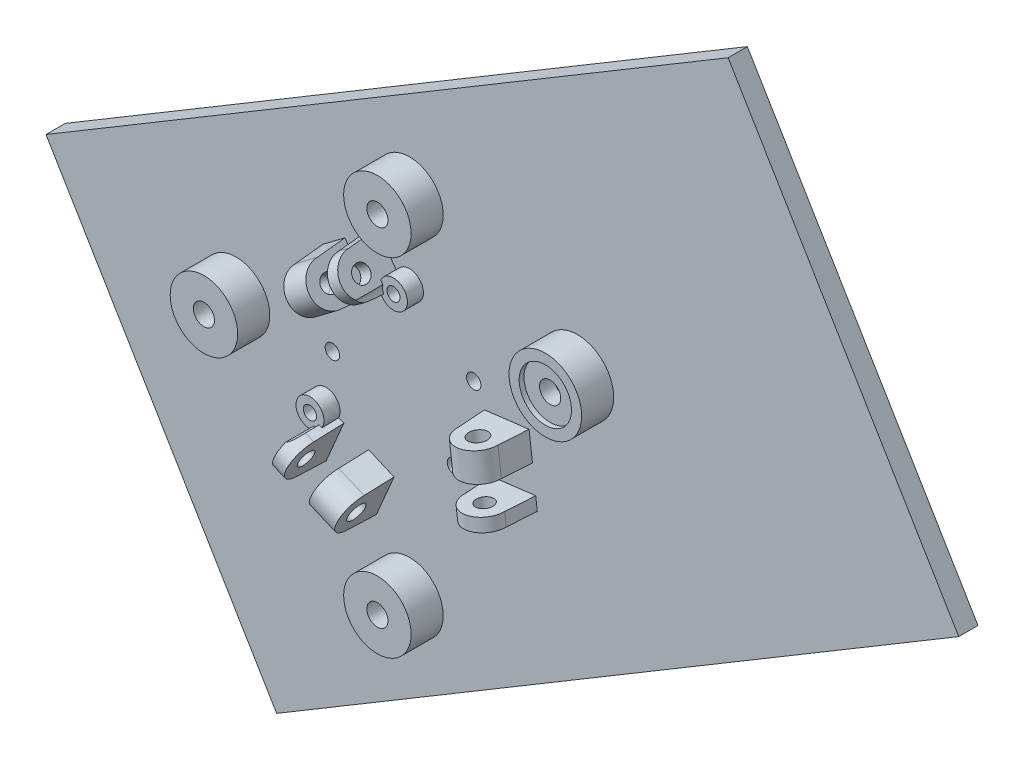
from build123d import *

# Parameters (mm, degrees)
F_01_START                                    = -12
F_01_PULLED_END_PLATE_OUTLINE_DEPTH           = 6
F_02_START                                    = -12.1
S02_CAGE_AND_TRACK_MOUNTING_HOLES_M6_R        = 3.3
F_02_CAGE_AND_TRACK_MOUNTING_HOLES_M6_DEPTH   = 6.2
F_03_START                                    = -12.1
S03_RESERVED_CASSETTE_PATTERN_M4_R            = 2.25
F_03_RESERVED_CASSETTE_PATTERN_M4_DEPTH       = 6.2
F_04_START                                    = -7.5
S04_TRACK_POST_LOCATING_SEAT_R                = 8.15
F_04_TRACK_POST_LOCATING_SEAT_DEPTH           = 1.6
F_05_START                                    = -6
S05_THREE_TENDON_GUIDE_BOSSES_R               = 4.35
F_05_THREE_TENDON_GUIDE_BOSSES_DEPTH          = 5
F_06_START                                    = 4.2
F_06_PIVOT_1_NEAR_CHEEK_DEPTH                 = 4
F_07_START                                    = -12.8
F_07_PIVOT_1_INSERT_CHEEK_DEPTH               = 8.6
F_08_START                                    = -12.9
S08_PIVOT_1_PIN_PILOT_R                       = 2.1
F_08_PIVOT_1_PIN_PILOT_DEPTH                  = 21.2
F_09_START                                    = -7.95
S09_PIVOT_1_SMOOTH_SHOULDER_BEARING_R         = 2.6
F_09_PIVOT_1_SMOOTH_SHOULDER_BEARING_DEPTH    = 16.25
F_10_START                                    = -12.9
S10_PIVOT_1_M4_SHORT_INSERT_SEAT_R            = 2.85
F_10_PIVOT_1_M4_SHORT_INSERT_SEAT_DEPTH       = 5.1
F_11_START                                    = 4.2
F_11_PIVOT_2_NEAR_CHEEK_DEPTH                 = 4
F_12_START                                    = -12.8
F_12_PIVOT_2_INSERT_CHEEK_DEPTH               = 8.6
F_13_START                                    = -12.9
S13_PIVOT_2_PIN_PILOT_R                       = 2.1
F_13_PIVOT_2_PIN_PILOT_DEPTH                  = 21.2
F_14_START                                    = -7.95
S14_PIVOT_2_SMOOTH_SHOULDER_BEARING_R         = 2.6
F_14_PIVOT_2_SMOOTH_SHOULDER_BEARING_DEPTH    = 16.25
F_15_START                                    = -12.9
S15_PIVOT_2_M4_SHORT_INSERT_SEAT_R            = 2.85
F_15_PIVOT_2_M4_SHORT_INSERT_SEAT_DEPTH       = 5.1
F_16_START                                    = 4.2
F_16_PIVOT_3_NEAR_CHEEK_DEPTH                 = 4
F_17_START                                    = -12.8
F_17_PIVOT_3_INSERT_CHEEK_DEPTH               = 8.6
F_18_START                                    = -12.9
S18_PIVOT_3_PIN_PILOT_R                       = 2.1
F_18_PIVOT_3_PIN_PILOT_DEPTH                  = 21.2
F_19_START                                    = -7.95
S19_PIVOT_3_SMOOTH_SHOULDER_BEARING_R         = 2.6
F_19_PIVOT_3_SMOOTH_SHOULDER_BEARING_DEPTH    = 16.25
F_20_START                                    = -12.9
S20_PIVOT_3_M4_SHORT_INSERT_SEAT_R            = 2.85
F_20_PIVOT_3_M4_SHORT_INSERT_SEAT_DEPTH       = 5.1
F_21_START                                    = -12.1
S21_TENDON_EYELET_SEATS_R                     = 2.05
F_21_TENDON_EYELET_SEATS_DEPTH                = 11.2
F_22_START                                    = -1
S22_CLEAR_THE_THREE_EYELET_FLANGES_AND_R      = 3.4
F_22_CLEAR_THE_THREE_EYELET_FLANGES_AND_DEPTH = 12
F_01_START_2                                  = -6.15
S01_RAISED_CAGE_SEATS_10_MM_R                 = 10.5
S01_RAISED_CAGE_SEATS_10_MM_R_2               = 11.3
F_01_RAISED_CAGE_SEATS_10_MM_DEPTH            = 10.15
S02_CAGE_SCREW_THROUGH_HOLES_R                = 3.3
F_02_CAGE_SCREW_THROUGH_HOLES_DEPTH           = 16.2
F_03_START_2                                  = -12.15
S03_RECESSED_FRAME_SCREW_HEAD_SEATS_R         = 6.15
F_03_RECESSED_FRAME_SCREW_HEAD_SEATS_DEPTH    = 10.15
F_04_START_2                                  = -12.15
S04_RECESSED_TRACK_POST_WASHER_SEAT_R         = 7.3
F_04_RECESSED_TRACK_POST_WASHER_SEAT_DEPTH    = 10.15
F_05_START_2                                  = 2.5
S05_TRACK_POST_LOCATION_REGISTER_R            = 8.15
F_05_TRACK_POST_LOCATION_REGISTER_DEPTH       = 1.6


with BuildPart() as part:
    # S01 - Pulled end plate outline → 01 - Pulled end plate outline (new body)
    with BuildSketch(Plane.XY.offset(F_01_START)):
        Polygon((170.996313, 20.6243307), (-41.3567354, -106.252626), (-113.163433, 13.929728), (99.1896147, 140.806684), align=None)
    extrude(amount=F_01_PULLED_END_PLATE_OUTLINE_DEPTH)

    # S02 - Cage and track mounting holes - M6 → 02 - Cage and track mounting holes - M6 (cut)
    with BuildSketch(Plane.XY.offset(F_02_START)):
        with Locations((0, 54)):
            Circle(S02_CAGE_AND_TRACK_MOUNTING_HOLES_M6_R)
        with Locations((-54, 0)):
            Circle(S02_CAGE_AND_TRACK_MOUNTING_HOLES_M6_R)
        with Locations((0, -54)):
            Circle(S02_CAGE_AND_TRACK_MOUNTING_HOLES_M6_R)
        with Locations((52.287205346, 31.41732257)):
            Circle(S02_CAGE_AND_TRACK_MOUNTING_HOLES_M6_R)
    extrude(amount=F_02_CAGE_AND_TRACK_MOUNTING_HOLES_M6_DEPTH, mode=Mode.SUBTRACT)

    # S03 - Reserved cassette pattern - M4 → 03 - Reserved cassette pattern - M4 (cut)
    with BuildSketch(Plane.XY.offset(F_03_START)):
        with Locations((14, -12)):
            Circle(S03_RESERVED_CASSETTE_PATTERN_M4_R)
        with Locations((20, 14)):
            Circle(S03_RESERVED_CASSETTE_PATTERN_M4_R)
        with Locations((-24, 0)):
            Circle(S03_RESERVED_CASSETTE_PATTERN_M4_R)
    extrude(amount=F_03_RESERVED_CASSETTE_PATTERN_M4_DEPTH, mode=Mode.SUBTRACT)

    # S04 - Track post locating seat → 04 - Track post locating seat (cut)
    with BuildSketch(Plane.XY.offset(F_04_START)):
        with Locations((52.287205346, 31.41732257)):
            Circle(S04_TRACK_POST_LOCATING_SEAT_R)
    extrude(amount=F_04_TRACK_POST_LOCATING_SEAT_DEPTH, mode=Mode.SUBTRACT)

    # S05 - Three tendon guide bosses → 05 - Three tendon guide bosses (add)
    with BuildSketch(Plane.XY.offset(F_05_START)):
        with Locations((25.980762114, -15)):
            Circle(S05_THREE_TENDON_GUIDE_BOSSES_R)
        with Locations((0, 30)):
            Circle(S05_THREE_TENDON_GUIDE_BOSSES_R)
        with Locations((-25.980762114, -15)):
            Circle(S05_THREE_TENDON_GUIDE_BOSSES_R)
    extrude(amount=F_05_THREE_TENDON_GUIDE_BOSSES_DEPTH)

    # S06 - Pivot 1 - near cheek → 06 - Pivot 1 - near cheek (add)
    with BuildSketch(Plane(origin=(0.946263216, -7.706695423, 0), x_dir=(-0.9925461516079791, -0.12186934367670445, 0), z_dir=(0.12186934367670443, -0.992546151607979, 0)).offset(F_06_START)):
        with BuildLine():
            Line((-24.147544543, 6.2), (-38.147544535, 6.2))
            Line((-38.147544535, 6.2), (-37.447544535, -3))
            ThreePointArc((-37.447544535, -3), (-31.147544539, -9.3), (-24.847544543, -3))
            Line((-24.847544543, -3), (-24.147544543, 6.2))
        make_face()
    extrude(amount=F_06_PIVOT_1_NEAR_CHEEK_DEPTH)

    # S07 - Pivot 1 - insert cheek → 07 - Pivot 1 - insert cheek (add)
    with BuildSketch(Plane(origin=(0.946263216, -7.706695423, 0), x_dir=(-0.9925461516079791, -0.12186934367670445, 0), z_dir=(0.12186934367670443, -0.992546151607979, 0)).offset(F_07_START)):
        with BuildLine():
            Line((-24.147544543, 6.2), (-38.147544535, 6.2))
            Line((-38.147544535, 6.2), (-37.447544535, -3))
            ThreePointArc((-37.447544535, -3), (-31.147544539, -9.3), (-24.847544543, -3))
            Line((-24.847544543, -3), (-24.147544543, 6.2))
        make_face()
    extrude(amount=F_07_PIVOT_1_INSERT_CHEEK_DEPTH)

    # S08 - Pivot 1 - pin pilot → 08 - Pivot 1 - pin pilot (cut)
    with BuildSketch(Plane(origin=(0.946263216, -7.706695423, 0), x_dir=(-0.9925461516079791, -0.12186934367670445, 0), z_dir=(0.12186934367670443, -0.992546151607979, 0)).offset(F_08_START)):
        with Locations((-31.147544539, -3)):
            Circle(S08_PIVOT_1_PIN_PILOT_R)
    extrude(amount=F_08_PIVOT_1_PIN_PILOT_DEPTH, mode=Mode.SUBTRACT)

    # S09 - Pivot 1 - smooth shoulder bearing → 09 - Pivot 1 - smooth shoulder bearing (cut)
    with BuildSketch(Plane(origin=(0.946263216, -7.706695423, 0), x_dir=(-0.9925461516079791, -0.12186934367670445, 0), z_dir=(0.12186934367670443, -0.992546151607979, 0)).offset(F_09_START)):
        with Locations((-31.147544539, -3)):
            Circle(S09_PIVOT_1_SMOOTH_SHOULDER_BEARING_R)
    extrude(amount=F_09_PIVOT_1_SMOOTH_SHOULDER_BEARING_DEPTH, mode=Mode.SUBTRACT)

    # S10 - Pivot 1 - M4 short insert seat → 10 - Pivot 1 - M4 short insert seat (cut)
    with BuildSketch(Plane(origin=(0.946263216, -7.706695423, 0), x_dir=(-0.9925461516079791, -0.12186934367670445, 0), z_dir=(0.12186934367670443, -0.992546151607979, 0)).offset(F_10_START)):
        with Locations((-31.147544539, -3)):
            Circle(S10_PIVOT_1_M4_SHORT_INSERT_SEAT_R)
    extrude(amount=F_10_PIVOT_1_M4_SHORT_INSERT_SEAT_DEPTH, mode=Mode.SUBTRACT)

    # S11 - Pivot 2 - near cheek → 11 - Pivot 2 - near cheek (add)
    with BuildSketch(Plane(origin=(6.201062381, 4.672835668, 0), x_dir=(0, 0, -1), z_dir=(0.7986355103156061, 0.6018150227959849, 0)).offset(F_11_START)):
        with BuildLine():
            Line((6.2, 24.14754453), (6.2, 38.147544534))
            Line((6.2, 38.147544534), (-3, 37.447544534))
            ThreePointArc((-3, 37.447544534), (-9.3, 31.147544532), (-3, 24.84754453))
            Line((-3, 24.84754453), (6.2, 24.14754453))
        make_face()
    extrude(amount=F_11_PIVOT_2_NEAR_CHEEK_DEPTH)

    # S12 - Pivot 2 - insert cheek → 12 - Pivot 2 - insert cheek (add)
    with BuildSketch(Plane(origin=(6.201062381, 4.672835668, 0), x_dir=(0, 0, -1), z_dir=(0.7986355103156061, 0.6018150227959849, 0)).offset(F_12_START)):
        with BuildLine():
            Line((6.2, 24.14754453), (6.2, 38.147544534))
            Line((6.2, 38.147544534), (-3, 37.447544534))
            ThreePointArc((-3, 37.447544534), (-9.3, 31.147544532), (-3, 24.84754453))
            Line((-3, 24.84754453), (6.2, 24.14754453))
        make_face()
    extrude(amount=F_12_PIVOT_2_INSERT_CHEEK_DEPTH)

    # S13 - Pivot 2 - pin pilot → 13 - Pivot 2 - pin pilot (cut)
    with BuildSketch(Plane(origin=(6.201062381, 4.672835668, 0), x_dir=(0, 0, -1), z_dir=(0.7986355103156061, 0.6018150227959849, 0)).offset(F_13_START)):
        with Locations((-3, 31.147544532)):
            Circle(S13_PIVOT_2_PIN_PILOT_R)
    extrude(amount=F_13_PIVOT_2_PIN_PILOT_DEPTH, mode=Mode.SUBTRACT)

    # S14 - Pivot 2 - smooth shoulder bearing → 14 - Pivot 2 - smooth shoulder bearing (cut)
    with BuildSketch(Plane(origin=(6.201062381, 4.672835668, 0), x_dir=(0, 0, -1), z_dir=(0.7986355103156061, 0.6018150227959849, 0)).offset(F_14_START)):
        with Locations((-3, 31.147544532)):
            Circle(S14_PIVOT_2_SMOOTH_SHOULDER_BEARING_R)
    extrude(amount=F_14_PIVOT_2_SMOOTH_SHOULDER_BEARING_DEPTH, mode=Mode.SUBTRACT)

    # S15 - Pivot 2 - M4 short insert seat → 15 - Pivot 2 - M4 short insert seat (cut)
    with BuildSketch(Plane(origin=(6.201062381, 4.672835668, 0), x_dir=(0, 0, -1), z_dir=(0.7986355103156061, 0.6018150227959849, 0)).offset(F_15_START)):
        with Locations((-3, 31.147544532)):
            Circle(S15_PIVOT_2_M4_SHORT_INSERT_SEAT_R)
    extrude(amount=F_15_PIVOT_2_M4_SHORT_INSERT_SEAT_DEPTH, mode=Mode.SUBTRACT)

    # S16 - Pivot 3 - near cheek → 16 - Pivot 3 - near cheek (add)
    with BuildSketch(Plane(origin=(-7.147325625, 3.033859732, 0), x_dir=(0, 0, 1), z_dir=(-0.9205048534161142, 0.39073112857485304, 0)).offset(F_16_START)):
        with BuildLine():
            Line((-6.2, -24.147544532), (-6.2, -38.14754453))
            Line((-6.2, -38.14754453), (3, -37.44754453))
            ThreePointArc((3, -37.44754453), (9.3, -31.147544531), (3, -24.847544531))
            Line((3, -24.847544531), (-6.2, -24.147544532))
        make_face()
    extrude(amount=F_16_PIVOT_3_NEAR_CHEEK_DEPTH)

    # S17 - Pivot 3 - insert cheek → 17 - Pivot 3 - insert cheek (add)
    with BuildSketch(Plane(origin=(-7.147325625, 3.033859732, 0), x_dir=(0, 0, 1), z_dir=(-0.9205048534161142, 0.39073112857485304, 0)).offset(F_17_START)):
        with BuildLine():
            Line((-6.2, -24.147544532), (-6.2, -38.14754453))
            Line((-6.2, -38.14754453), (3, -37.44754453))
            ThreePointArc((3, -37.44754453), (9.3, -31.147544531), (3, -24.847544531))
            Line((3, -24.847544531), (-6.2, -24.147544532))
        make_face()
    extrude(amount=F_17_PIVOT_3_INSERT_CHEEK_DEPTH)

    # S18 - Pivot 3 - pin pilot → 18 - Pivot 3 - pin pilot (cut)
    with BuildSketch(Plane(origin=(-7.147325625, 3.033859732, 0), x_dir=(0, 0, 1), z_dir=(-0.9205048534161142, 0.39073112857485304, 0)).offset(F_18_START)):
        with Locations((3, -31.147544531)):
            Circle(S18_PIVOT_3_PIN_PILOT_R)
    extrude(amount=F_18_PIVOT_3_PIN_PILOT_DEPTH, mode=Mode.SUBTRACT)

    # S19 - Pivot 3 - smooth shoulder bearing → 19 - Pivot 3 - smooth shoulder bearing (cut)
    with BuildSketch(Plane(origin=(-7.147325625, 3.033859732, 0), x_dir=(0, 0, 1), z_dir=(-0.9205048534161142, 0.39073112857485304, 0)).offset(F_19_START)):
        with Locations((3, -31.147544531)):
            Circle(S19_PIVOT_3_SMOOTH_SHOULDER_BEARING_R)
    extrude(amount=F_19_PIVOT_3_SMOOTH_SHOULDER_BEARING_DEPTH, mode=Mode.SUBTRACT)

    # S20 - Pivot 3 - M4 short insert seat → 20 - Pivot 3 - M4 short insert seat (cut)
    with BuildSketch(Plane(origin=(-7.147325625, 3.033859732, 0), x_dir=(0, 0, 1), z_dir=(-0.9205048534161142, 0.39073112857485304, 0)).offset(F_20_START)):
        with Locations((3, -31.147544531)):
            Circle(S20_PIVOT_3_M4_SHORT_INSERT_SEAT_R)
    extrude(amount=F_20_PIVOT_3_M4_SHORT_INSERT_SEAT_DEPTH, mode=Mode.SUBTRACT)

    # S21 - Tendon eyelet seats → 21 - Tendon eyelet seats (cut)
    with BuildSketch(Plane.XY.offset(F_21_START)):
        with Locations((25.980762114, -15)):
            Circle(S21_TENDON_EYELET_SEATS_R)
        with Locations((0, 30)):
            Circle(S21_TENDON_EYELET_SEATS_R)
        with Locations((-25.980762114, -15)):
            Circle(S21_TENDON_EYELET_SEATS_R)
    extrude(amount=F_21_TENDON_EYELET_SEATS_DEPTH, mode=Mode.SUBTRACT)

    # S22 - Clear the three eyelet flanges and cord exits → 22 - Clear the three eyelet flanges and cord exits (cut)
    with BuildSketch(Plane.XY.offset(F_22_START)):
        with Locations((25.980762114, -15)):
            Circle(S22_CLEAR_THE_THREE_EYELET_FLANGES_AND_R)
        with Locations((0, 30)):
            Circle(S22_CLEAR_THE_THREE_EYELET_FLANGES_AND_R)
        with Locations((-25.980762114, -15)):
            Circle(S22_CLEAR_THE_THREE_EYELET_FLANGES_AND_R)
    extrude(amount=F_22_CLEAR_THE_THREE_EYELET_FLANGES_AND_DEPTH, mode=Mode.SUBTRACT)

    # S01 - Raised cage seats - 10 mm → 01 - Raised cage seats - 10 mm (add)
    with BuildSketch(Plane.XY.offset(F_01_START_2)):
        with Locations((0, 54)):
            Circle(S01_RAISED_CAGE_SEATS_10_MM_R)
        with Locations((-54, 0)):
            Circle(S01_RAISED_CAGE_SEATS_10_MM_R)
        with Locations((0, -54)):
            Circle(S01_RAISED_CAGE_SEATS_10_MM_R)
        with Locations((52.287205346, 31.41732257)):
            Circle(S01_RAISED_CAGE_SEATS_10_MM_R_2)
    extrude(amount=F_01_RAISED_CAGE_SEATS_10_MM_DEPTH)

    # S02 - Cage screw through holes → 02 - Cage screw through holes (cut)
    with BuildSketch(Plane.XY.offset(F_02_START)):
        with Locations((0, 54)):
            Circle(S02_CAGE_SCREW_THROUGH_HOLES_R)
        with Locations((-54, 0)):
            Circle(S02_CAGE_SCREW_THROUGH_HOLES_R)
        with Locations((0, -54)):
            Circle(S02_CAGE_SCREW_THROUGH_HOLES_R)
        with Locations((52.287205346, 31.41732257)):
            Circle(S02_CAGE_SCREW_THROUGH_HOLES_R)
    extrude(amount=F_02_CAGE_SCREW_THROUGH_HOLES_DEPTH, mode=Mode.SUBTRACT)

    # S03 - Recessed frame screw head seats → 03 - Recessed frame screw head seats (cut)
    with BuildSketch(Plane.XY.offset(F_03_START_2)):
        with Locations((0, 54)):
            Circle(S03_RECESSED_FRAME_SCREW_HEAD_SEATS_R)
        with Locations((-54, 0)):
            Circle(S03_RECESSED_FRAME_SCREW_HEAD_SEATS_R)
        with Locations((0, -54)):
            Circle(S03_RECESSED_FRAME_SCREW_HEAD_SEATS_R)
    extrude(amount=F_03_RECESSED_FRAME_SCREW_HEAD_SEATS_DEPTH, mode=Mode.SUBTRACT)

    # S04 - Recessed track post washer seat → 04 - Recessed track post washer seat (cut)
    with BuildSketch(Plane.XY.offset(F_04_START_2)):
        with Locations((52.287205346, 31.41732257)):
            Circle(S04_RECESSED_TRACK_POST_WASHER_SEAT_R)
    extrude(amount=F_04_RECESSED_TRACK_POST_WASHER_SEAT_DEPTH, mode=Mode.SUBTRACT)

    # S05 - Track post location register → 05 - Track post location register (cut)
    with BuildSketch(Plane.XY.offset(F_05_START_2)):
        with Locations((52.287205346, 31.41732257)):
            Circle(S05_TRACK_POST_LOCATION_REGISTER_R)
    extrude(amount=F_05_TRACK_POST_LOCATION_REGISTER_DEPTH, mode=Mode.SUBTRACT)


solid = part.part
